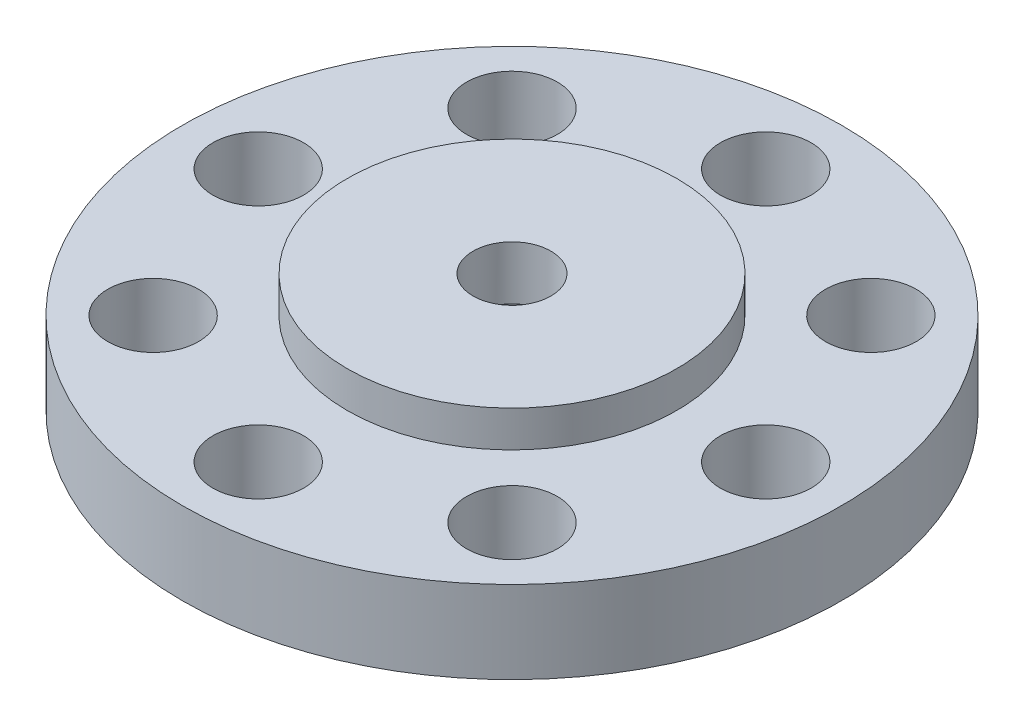
from build123d import *

# Parameters (mm, degrees)
SKETCH1_R               = 12.7
BOSS_EXTRUDE1_DEPTH     = 3.175
SKETCH2_R               = 6.35
BOSS_EXTRUDE2_DEPTH     = 1.397
CUT_EXTRUDE1_DEPTH      = 19.533299329
CUT_EXTRUDE1_DEPTH_BACK = 19.533299329
SKETCH3_R               = 1.5
SKETCH4_R               = 1.75
CUT_EXTRUDE2_DEPTH      = 19.238986403
CIRPATTERN1_COUNT       = 8
SKETCH5_R               = 2.5
CUT_EXTRUDE3_DEPTH      = 2.5


with BuildPart() as part:
    # Sketch1 → Boss-Extrude1 (new body)
    with BuildSketch(Plane(origin=(0, 0, 0), x_dir=(1, 0, 0), z_dir=(0, 1, 0))):
        with Locations(Location((0, 0, 0), (0, 0, 270))):
            Circle(SKETCH1_R)
    extrude(amount=-BOSS_EXTRUDE1_DEPTH)

    # Sketch2 → Boss-Extrude2 (add)
    with BuildSketch(Plane(origin=(0, 0, 0), x_dir=(1, 0, 0), z_dir=(0, 1, 0))):
        with Locations(Location((0, 0, 0), (0, 0, 270))):
            Circle(SKETCH2_R)
    extrude(amount=BOSS_EXTRUDE2_DEPTH)

    # Sketch3 → Cut-Extrude1 (cut, two sides: drawn at the far end of the back side and taken through both)
    with BuildSketch(Plane(origin=(0, 1.397, 0), x_dir=(1, 0, 0), z_dir=(0, 1, 0)).offset(-CUT_EXTRUDE1_DEPTH_BACK)):
        with Locations(Location((0, 0, 0), (0, 0, 270))):
            Circle(SKETCH3_R)
    extrude(amount=CUT_EXTRUDE1_DEPTH + CUT_EXTRUDE1_DEPTH_BACK, mode=Mode.SUBTRACT)

    # Sketch4 → Cut-Extrude2 (cut, symmetric)
    with BuildSketch(Plane(origin=(0, 0, 0), x_dir=(1, 0, 0), z_dir=(0, 1, 0))):
        with Locations(Location((0, -9.779, 0), (0, 0, 270))):
            Circle(SKETCH4_R)
    cut_extrude2 = extrude(amount=CUT_EXTRUDE2_DEPTH, both=True, mode=Mode.SUBTRACT)

    # CirPattern1: Cut-Extrude2 ×8 about axis
    cirpattern1_axis = Axis((0, 0, 0), (0, 1, 0))
    for i in range(1, CIRPATTERN1_COUNT):
        add(cut_extrude2.rotate(cirpattern1_axis, i * 360 / CIRPATTERN1_COUNT), mode=Mode.SUBTRACT)

    # Sketch5 → Cut-Extrude3 (cut)
    with BuildSketch(Plane.XZ.offset(3.175)):
        with Locations(Location((0, 0, 0), (0, 0, 270))):
            Circle(SKETCH5_R)
    extrude(amount=-CUT_EXTRUDE3_DEPTH, mode=Mode.SUBTRACT)


solid = part.part
